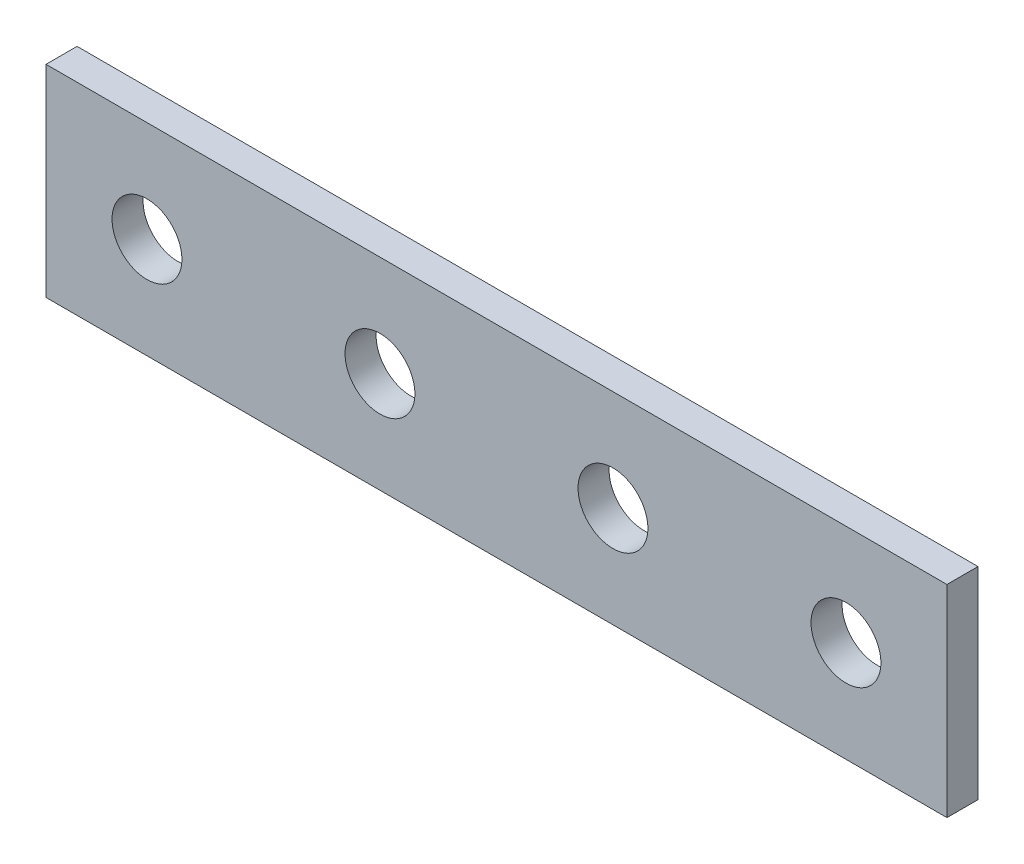
from build123d import *

# Parameters (mm, degrees)
SKETCH1_W           = 184.15
SKETCH1_H           = 41.275
SKETCH1_R           = 7.14375
BOSS_EXTRUDE1_DEPTH = 3.175


with BuildPart() as part:
    # Sketch1 → Boss-Extrude1 (new, symmetric)
    with BuildSketch(Plane.XY):
        Rectangle(SKETCH1_W, SKETCH1_H)
        with Locations((-71.4375, 0)):
            Circle(SKETCH1_R, mode=Mode.SUBTRACT)
        with Locations((-23.8125, 0)):
            Circle(SKETCH1_R, mode=Mode.SUBTRACT)
        with Locations((23.8125, 0)):
            Circle(SKETCH1_R, mode=Mode.SUBTRACT)
        with Locations((71.4375, 0)):
            Circle(SKETCH1_R, mode=Mode.SUBTRACT)
    extrude(amount=BOSS_EXTRUDE1_DEPTH, both=True)


solid = part.part
